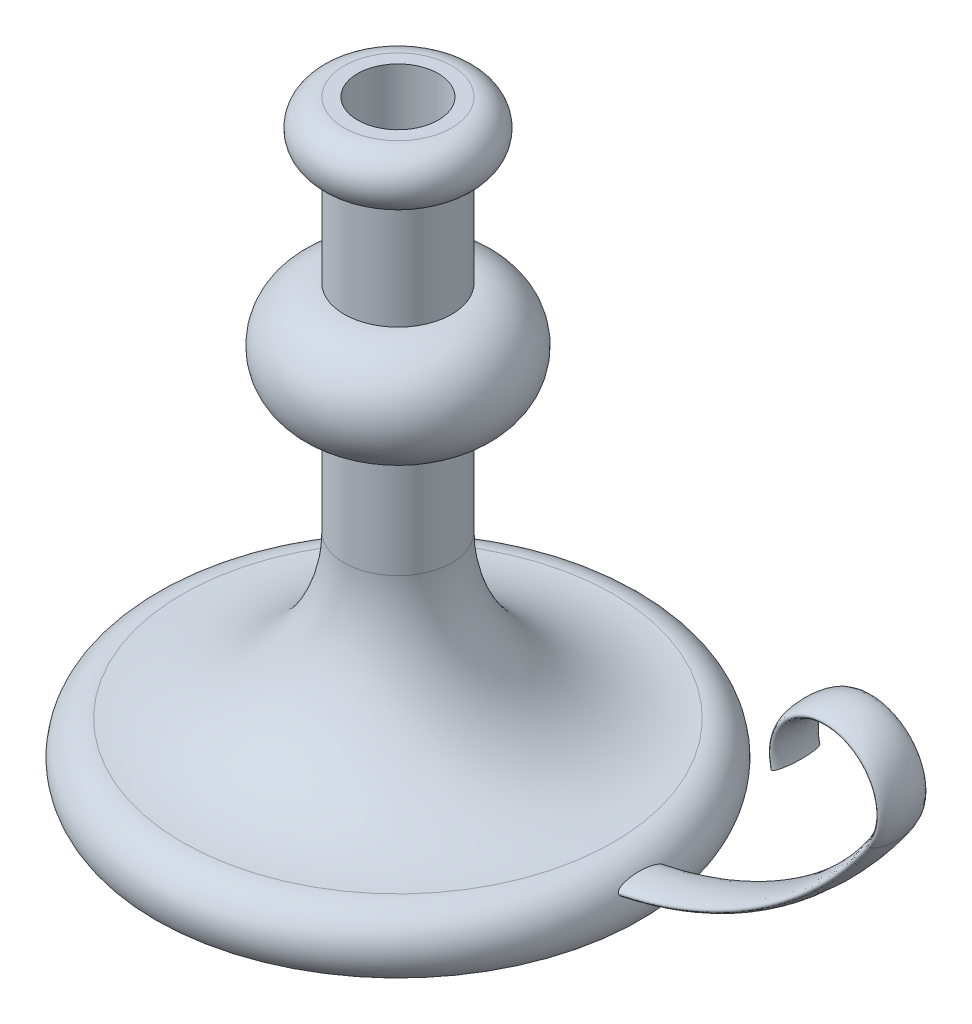
from build123d import *

# Parameters (mm, degrees)
CROQUIS2_RX           = 222.25
CROQUIS2_RY           = 63.5
CROQUIS4_R            = 381
CORTAR_EXTRUIR1_DEPTH = 581.914


with BuildPart() as part:
    # Croquis1 → Revolución1 (revolve)
    with BuildSketch(Plane.XY, mode=Mode.PRIVATE) as revoluci_n1_sk:
        with BuildLine():
            Line((2286, 0), (0, 0))
            Line((0, 0), (0, 5588))
            Line((0, 5588), (508, 5588))
            ThreePointArc((508, 5588), (762, 5334), (508, 5080))
            Line((508, 5080), (508, 4064))
            ThreePointArc((508, 4064), (1016, 3556), (508, 3048))
            Line((508, 3048), (508, 2032))
            ThreePointArc((508, 2032), (954.369265472, 954.369265472), (2032, 508))
            ThreePointArc((2032, 508), (2315.980633142, 332.490316571), (2286, 0))
        make_face()
    revolve(revoluci_n1_sk.sketch.rotate(Axis((0, 0, 0), (0, 1, 0)), 90), axis=Axis((0, 0, 0), (0, 1, 0)))

    # Barrer2: sweep along a path in Croquis3
    with BuildLine(Plane.XY) as barrer2_path:
        Line((0, 254), (1524, 254))
        ThreePointArc((1524, 254), (3297.458485559, 691.916815973), (4663.238601954, 1905))
        ThreePointArc((4663.238601954, 1905), (4334.375578315, 2692.884195437), (3752.145213981, 2068.448292735))
    # Croquis2 → Barrer2 (sweep)
    with BuildSketch(Plane(origin=(0, 0, 0), x_dir=(0, 0, -1), z_dir=(1, 0, 0))):
        with Locations((0, 254)):
            Ellipse(CROQUIS2_RX, CROQUIS2_RY)
    sweep(path=barrer2_path.line)

    # Croquis4 → Cortar-Extruir1 (cut)
    with BuildSketch(Plane(origin=(0, 5588, 0), x_dir=(1, 0, 0), z_dir=(0, 1, 0))):
        with Locations(Location((0, 0, 0), (0, 0, 270))):
            Circle(CROQUIS4_R)
    extrude(amount=-CORTAR_EXTRUIR1_DEPTH, mode=Mode.SUBTRACT)


solid = part.part
